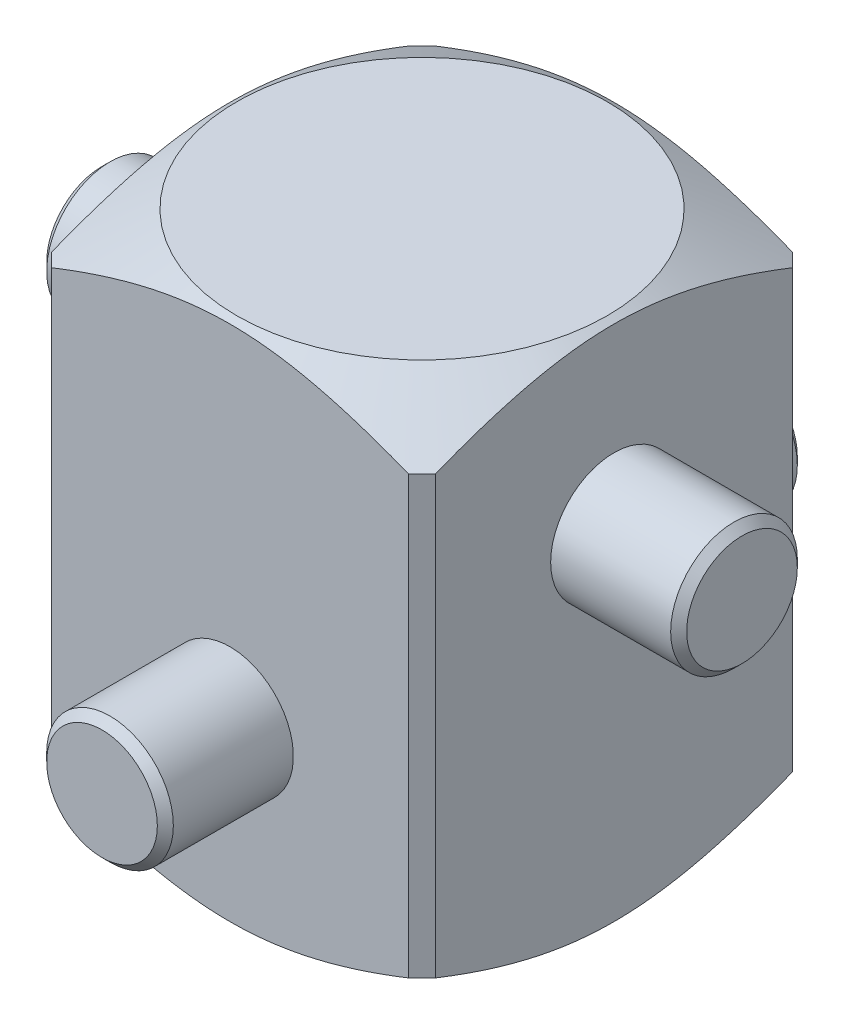
from build123d import *

# Parameters (mm, degrees)
SKETCH1_W           = 14.4
SKETCH1_H           = 14.4
BOSS_EXTRUDE1_DEPTH = 19.7
SKETCH3_R           = 2.375
BOSS_EXTRUDE2_DEPTH = 12
SKETCH4_R           = 2.375
BOSS_EXTRUDE3_DEPTH = 12
CHAMFER1_SIZE       = 0.3
CHAMFER2_SIZE       = 0.5
SCALE1_SCALE        = 0.49


with BuildPart() as part:
    # Sketch1 → Boss-Extrude1 (new body)
    with BuildSketch(Plane(origin=(0, 0, 0), x_dir=(1, 0, 0), z_dir=(0, 1, 0))):
        Rectangle(SKETCH1_W, SKETCH1_H)
    extrude(amount=BOSS_EXTRUDE1_DEPTH)

    # Sketch2 → Cut-Revolve1 (revolve, cut)
    with BuildSketch(Plane.XY, mode=Mode.PRIVATE) as cut_revolve1_sk:
        Polygon((-6.95, 19.7), (-16.09, 19.7), (-16.09, 0), (-6.95, 0), (-13.55, 3.810511777), (-13.55, 15.889488223), align=None)
    revolve(cut_revolve1_sk.sketch.rotate(Axis((0, 20.685, 0), (0, -1, 0)), 270), axis=Axis((0, 20.685, 0), (0, -1, 0)), mode=Mode.SUBTRACT)

    # Sketch3 → Boss-Extrude2 (add, symmetric)
    with BuildSketch(Plane.XY):
        with Locations(Location((0, 6.7, 0), (0, 0, 180))):
            Circle(SKETCH3_R)
    extrude(amount=BOSS_EXTRUDE2_DEPTH, both=True)

    # Sketch4 → Boss-Extrude3 (add, symmetric)
    with BuildSketch(Plane(origin=(0, 0, 0), x_dir=(0, 0, -1), z_dir=(1, 0, 0))):
        with Locations((0, 13)):
            Circle(SKETCH4_R)
    extrude(amount=BOSS_EXTRUDE3_DEPTH, both=True)

    # Chamfer1
    chamfer1_edges = [part.edges().sort_by_distance(p)[0] for p in [
        (2.375, 6.7, -12),
        (2.375, 6.7, 12),
        (-12, 13, 2.375),
        (12, 13, 2.375),
    ]]
    chamfer(chamfer1_edges, length=CHAMFER1_SIZE)

    # Chamfer2
    chamfer2_edges = [part.edges().sort_by_distance(p)[0] for p in [
        (7.2, 9.85, 7.2),
        (7.2, 9.85, -7.2),
        (-7.2, 9.85, 7.2),
        (-7.2, 9.85, -7.2),
    ]]
    chamfer(chamfer2_edges, length=CHAMFER2_SIZE)


with BuildPart() as part_1:
    # Scale1: scaled about (0, 9.85, 0)
    add(part.part.scale(SCALE1_SCALE).moved(Location((0, 5.0235, 0))))


solid = part_1.part
